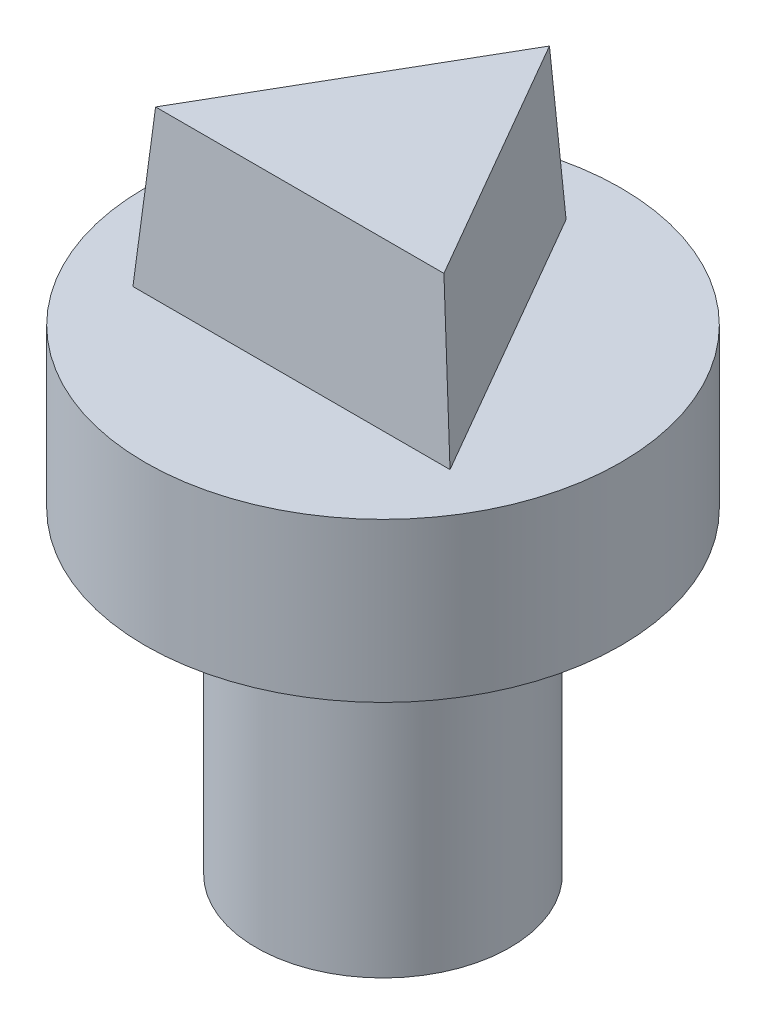
from build123d import *

# Parameters (mm, degrees)
SKETCH1_R           = 7.5
BOSS_EXTRUDE1_DEPTH = 5
BOSS_EXTRUDE2_DEPTH = 5
BOSS_EXTRUDE2_TAPER = 3
SKETCH3_R           = 4
BOSS_EXTRUDE3_DEPTH = 10


with BuildPart() as part:
    # Sketch1 → Boss-Extrude1 (new body)
    with BuildSketch(Plane(origin=(0, 0, 0), x_dir=(1, 0, 0), z_dir=(0, 1, 0))):
        with Locations(Location((0, 0, 0), (0, 0, 270))):
            Circle(SKETCH1_R)
    extrude(amount=BOSS_EXTRUDE1_DEPTH)

    # Sketch2 → Boss-Extrude2 (add)
    with BuildSketch(Plane(origin=(0, 5, 0), x_dir=(1, 0, 0), z_dir=(0, 1, 0))):
        Polygon((0, 5.773502692), (-5, -2.886751346), (5, -2.886751346), align=None)
    extrude(amount=BOSS_EXTRUDE2_DEPTH, taper=BOSS_EXTRUDE2_TAPER)

    # Sketch3 → Boss-Extrude3 (add)
    with BuildSketch(Plane.XZ):
        with Locations(Location((0, 0, 0), (0, 0, 270))):
            Circle(SKETCH3_R)
    extrude(amount=BOSS_EXTRUDE3_DEPTH)


solid = part.part
